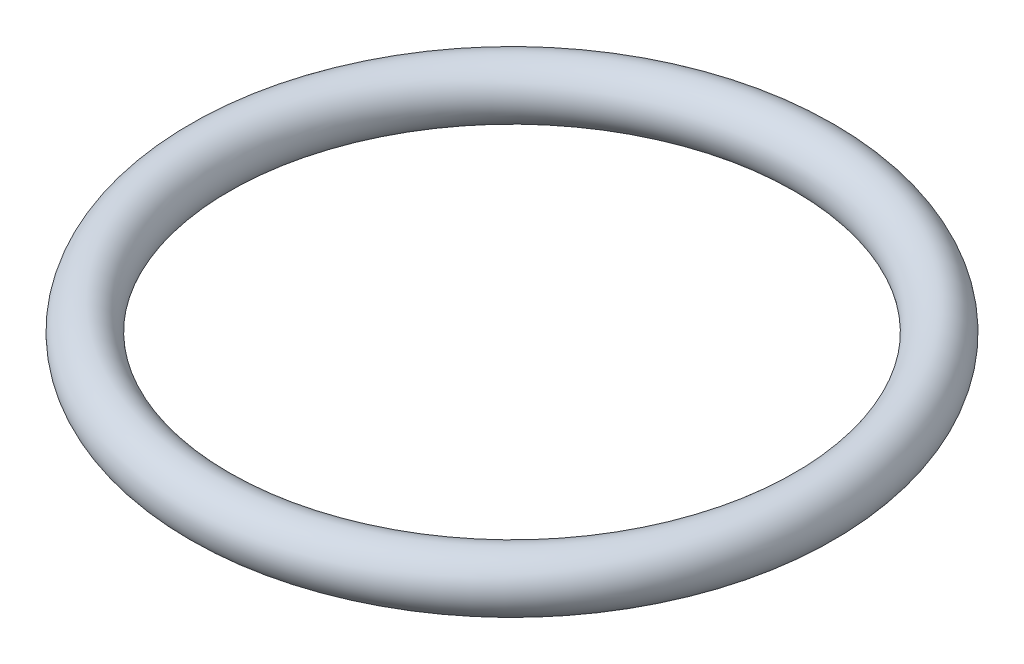
from build123d import *

# Parameters (mm, degrees)
SKETCH1_R = 0.79375


with BuildPart() as part:
    # Sketch1 → Revolve1 (revolve)
    with BuildSketch(Plane.XY, mode=Mode.PRIVATE) as revolve1_sk:
        with Locations((-8.73125, 0)):
            Circle(SKETCH1_R)
    revolve(revolve1_sk.sketch.rotate(Axis((0, 27.382641921, 0), (0, -1, 0)), 270), axis=Axis((0, 27.382641921, 0), (0, -1, 0)))


solid = part.part
